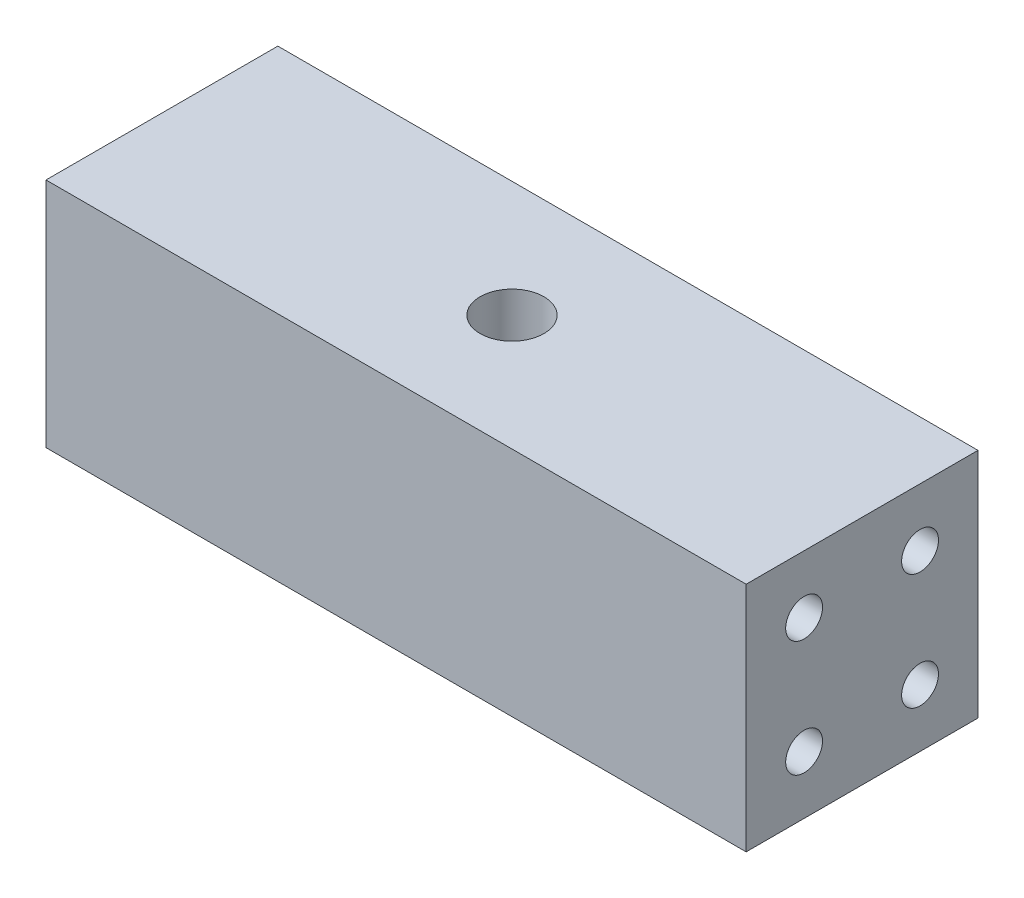
from build123d import *

# Parameters (mm, degrees)
SKETCH1_W                  = 76.708
SKETCH1_H                  = 25.4
BOSS_EXTRUDE1_DEPTH        = 25.4
F_10_32_TAPPED_HOLE1_D     = 4.0386
F_10_32_TAPPED_HOLE1_DEPTH = 8.636
F_10_32_TAPPED_HOLE1_TIP   = 1.213317848
F_10_32_TAPPED_HOLE2_D     = 4.0386
F_10_32_TAPPED_HOLE2_DEPTH = 8.636
F_10_32_TAPPED_HOLE2_TIP   = 1.213317848
F_6_0MM_DOWEL_HOLE1_D      = 7


with BuildPart() as part:
    # Sketch1 → Boss-Extrude1 (new body)
    with BuildSketch(Plane(origin=(0, 0, 0), x_dir=(1, 0, 0), z_dir=(0, 1, 0))):
        with Locations((38.354, 12.7)):
            Rectangle(SKETCH1_W, SKETCH1_H)
    extrude(amount=BOSS_EXTRUDE1_DEPTH)

    # #10-32 Tapped Hole1
    with Locations(Plane(origin=(76.708, 0, 0), x_dir=(0, 0, -1), z_dir=(1, 0, 0))):
        with Locations((6.35, 19.05), (19.05, 19.05), (19.05, 6.35), (6.35, 6.35)):
            Hole(F_10_32_TAPPED_HOLE1_D / 2, depth=F_10_32_TAPPED_HOLE1_DEPTH)
            with Locations((0, 0, -(F_10_32_TAPPED_HOLE1_DEPTH + F_10_32_TAPPED_HOLE1_TIP / 2))):  # 118° drill point
                Cone(0, F_10_32_TAPPED_HOLE1_D / 2, F_10_32_TAPPED_HOLE1_TIP, mode=Mode.SUBTRACT)

    # #10-32 Tapped Hole2
    with Locations(Plane.ZY):
        with Locations((-19.05, 19.05), (-6.35, 19.05), (-6.35, 6.35), (-19.05, 6.35)):
            Hole(F_10_32_TAPPED_HOLE2_D / 2, depth=F_10_32_TAPPED_HOLE2_DEPTH)
            with Locations((0, 0, -(F_10_32_TAPPED_HOLE2_DEPTH + F_10_32_TAPPED_HOLE2_TIP / 2))):  # 118° drill point
                Cone(0, F_10_32_TAPPED_HOLE2_D / 2, F_10_32_TAPPED_HOLE2_TIP, mode=Mode.SUBTRACT)

    # Ø6.0mm Dowel Hole1 (through all)
    with Locations(Plane(origin=(0, 25.4, 0), x_dir=(1, 0, 0), z_dir=(0, 1, 0))):
        with Locations((38.354, 12.7)):
            Hole(F_6_0MM_DOWEL_HOLE1_D / 2)


solid = part.part
